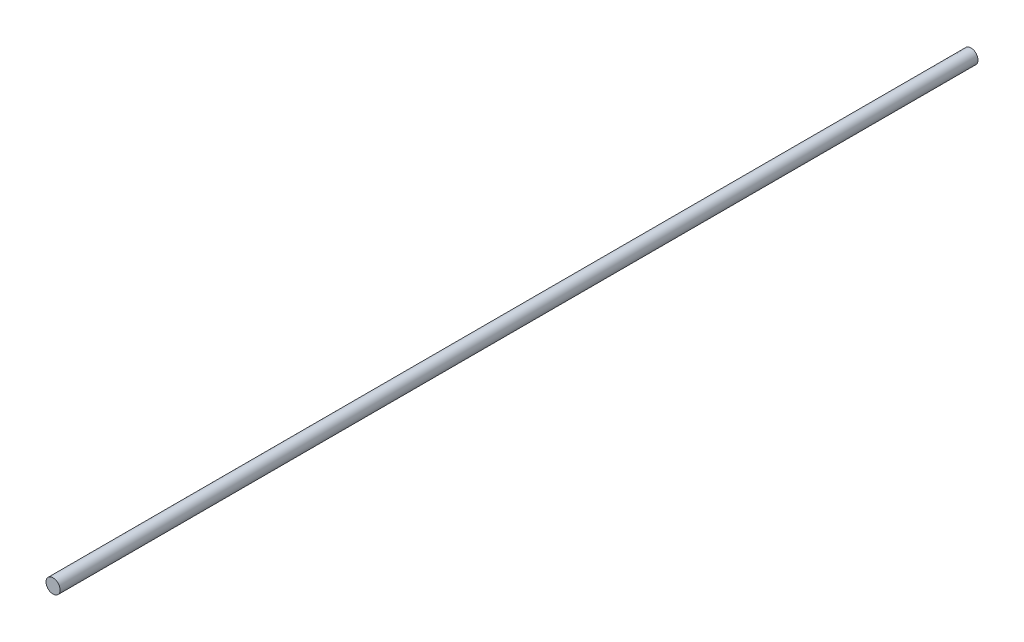
from build123d import *

# Parameters (mm, degrees)
SKIZZE1_R                       = 4
AUFSATZ_LINEAR_AUSTRAGEN1_DEPTH = 520


with BuildPart() as part:
    # Skizze1 → Aufsatz-Linear austragen1 (new body)
    with BuildSketch(Plane.XY):
        Circle(SKIZZE1_R)
    extrude(amount=AUFSATZ_LINEAR_AUSTRAGEN1_DEPTH)


solid = part.part
